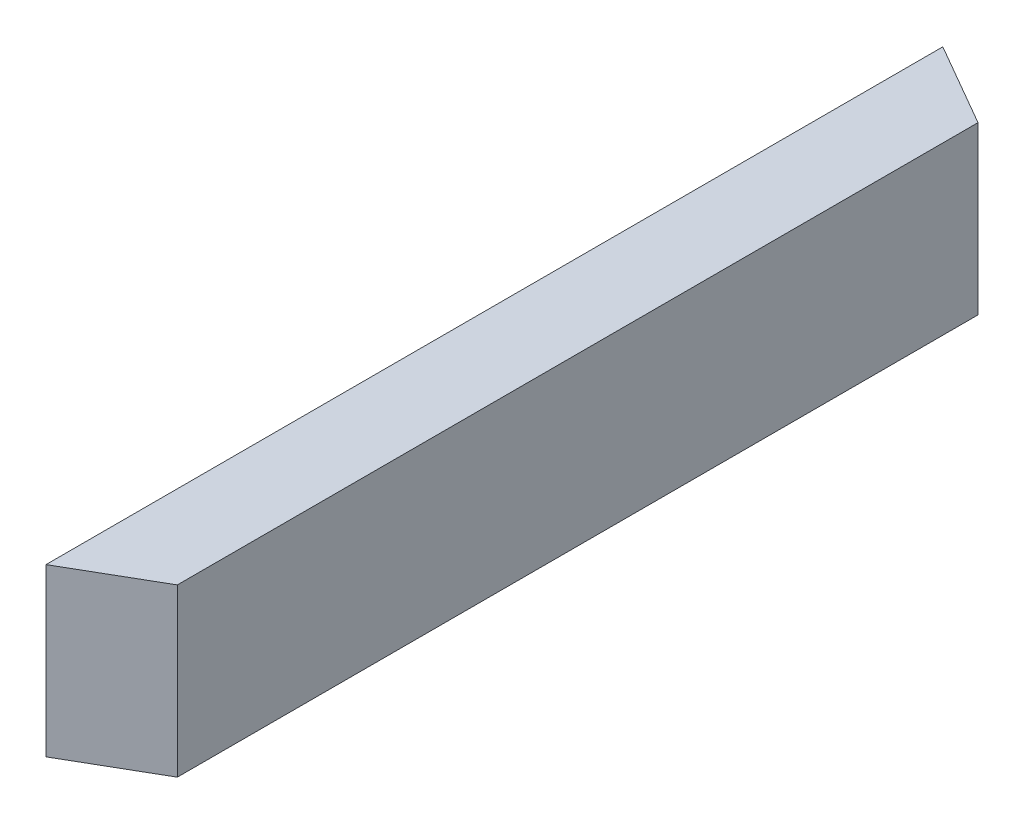
from build123d import *

# Parameters (mm, degrees)
SKETCH1_W           = 44.45
SKETCH1_H           = 88.9
BOSS_EXTRUDE1_DEPTH = 478.79
CUT_EXTRUDE1_DEPTH  = 478.79


with BuildPart() as part:
    # Sketch1 → Boss-Extrude1 (new body)
    with BuildSketch(Plane.XY):
        with Locations((-22.225, 44.45)):
            Rectangle(SKETCH1_W, SKETCH1_H)
    extrude(amount=BOSS_EXTRUDE1_DEPTH)

    # Sketch2 → Cut-Extrude1 (cut)
    with BuildSketch(Plane(origin=(0, 88.9, 0), x_dir=(1, 0, 0), z_dir=(0, 1, 0))):
        Polygon((-44.45, 0), (0, -25.663219465), (0, 0), align=None)
        Polygon((-44.45, -478.79), (0, -453.126780535), (0, -478.79), align=None)
    extrude(amount=-CUT_EXTRUDE1_DEPTH, mode=Mode.SUBTRACT)


solid = part.part
